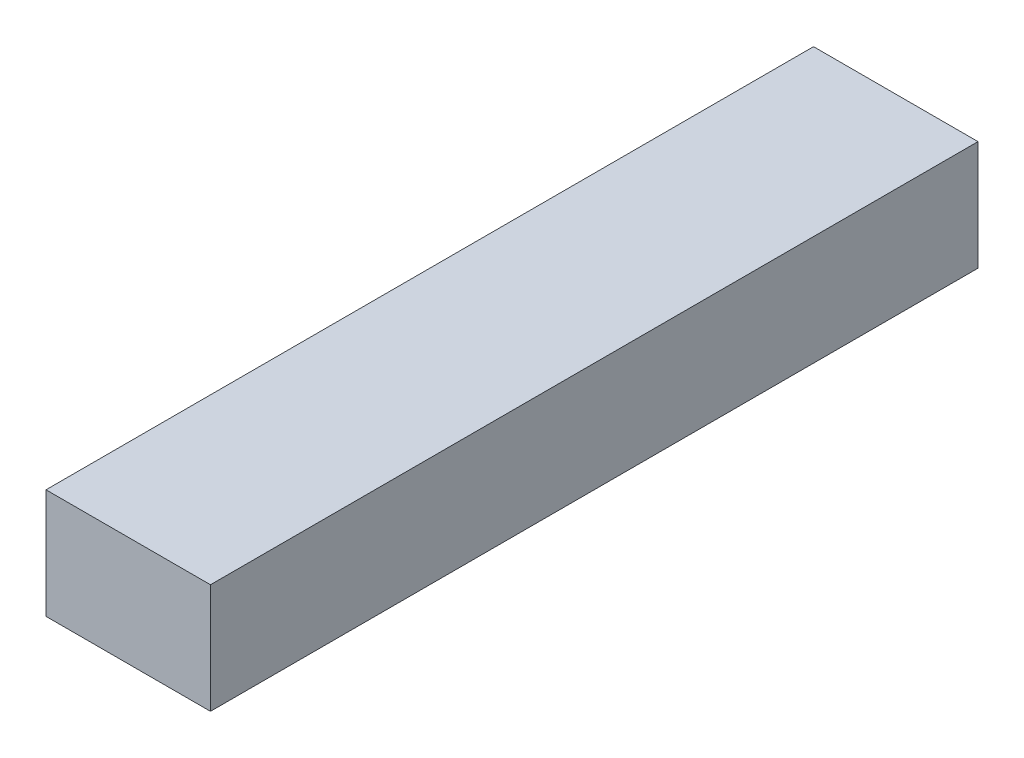
from build123d import *

# Parameters (mm, degrees)
SKETCH1_W           = 7.5
SKETCH1_H           = 35
BOSS_EXTRUDE1_DEPTH = 5


with BuildPart() as part:
    # Sketch1 → Boss-Extrude1 (new body)
    with BuildSketch(Plane(origin=(0, 0, 0), x_dir=(1, 0, 0), z_dir=(0, 1, 0))):
        with Locations((3.75, 17.5)):
            Rectangle(SKETCH1_W, SKETCH1_H)
    extrude(amount=BOSS_EXTRUDE1_DEPTH)


solid = part.part
